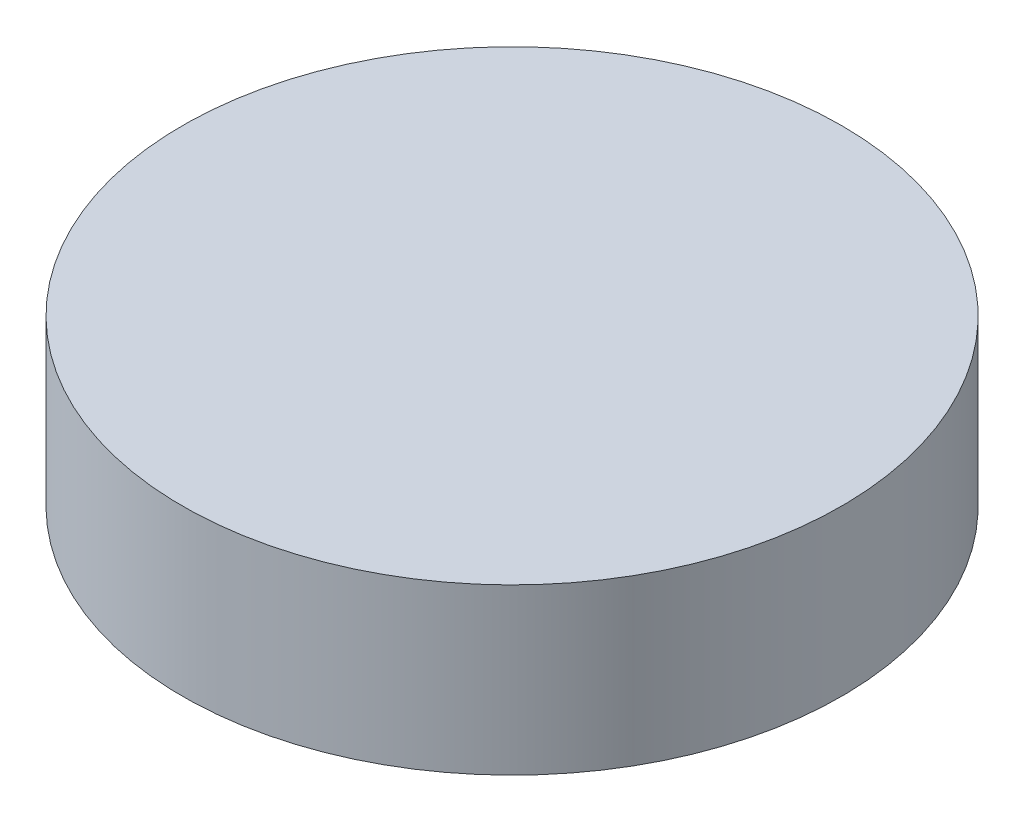
from build123d import *

# Parameters (mm, degrees)
SKETCH1_R           = 38.1
BOSS_EXTRUDE1_DEPTH = 19.05


with BuildPart() as part:
    # Sketch1 → Boss-Extrude1 (new body)
    with BuildSketch(Plane(origin=(0, 0, 0), x_dir=(1, 0, 0), z_dir=(0, 1, 0))):
        with Locations(Location((0, 0, 0), (0, 0, 90))):
            Circle(SKETCH1_R)
    extrude(amount=BOSS_EXTRUDE1_DEPTH)


solid = part.part
